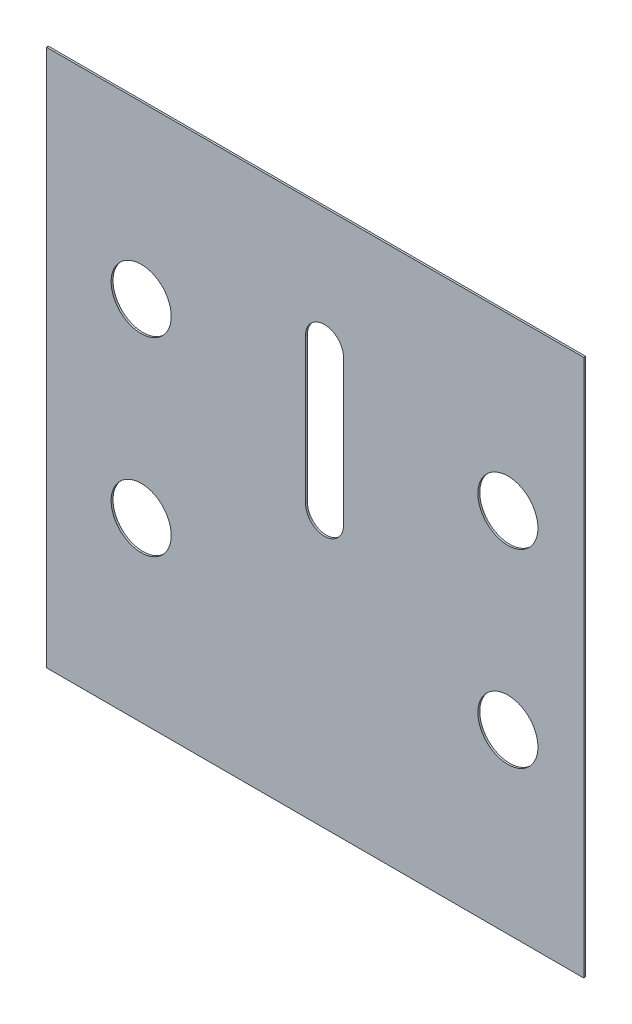
from build123d import *

# Parameters (mm, degrees)
SKETCH_1_W          = 850
SKETCH_1_H          = 850
EXTRUDE_1_DEPTH     = 3
SKETCH_2_R          = 47.5
CUT_EXTRUDE_1_DEPTH = 1203.085271518


with BuildPart() as part:
    # 草图1 → 凸台-拉伸1 (new body)
    with BuildSketch(Plane.XY):
        with Locations((425, 425)):
            Rectangle(SKETCH_1_W, SKETCH_1_H)
    extrude(amount=EXTRUDE_1_DEPTH)

    # 草图2 → 切除-拉伸1 (cut, through all)
    with BuildSketch(Plane.XY.offset(3)):
        with Locations((150, 580)):
            Circle(SKETCH_2_R)
        with Locations((150, 280)):
            Circle(SKETCH_2_R)
        with Locations((730, 280)):
            Circle(SKETCH_2_R)
        with Locations((730, 580)):
            Circle(SKETCH_2_R)
        with BuildLine():
            Line((470, 660), (470, 430))
            ThreePointArc((470, 430), (440, 400), (410, 430))
            Line((410, 430), (410, 660))
            ThreePointArc((410, 660), (440, 690), (470, 660))
        make_face()
    extrude(amount=-CUT_EXTRUDE_1_DEPTH, mode=Mode.SUBTRACT)


solid = part.part
